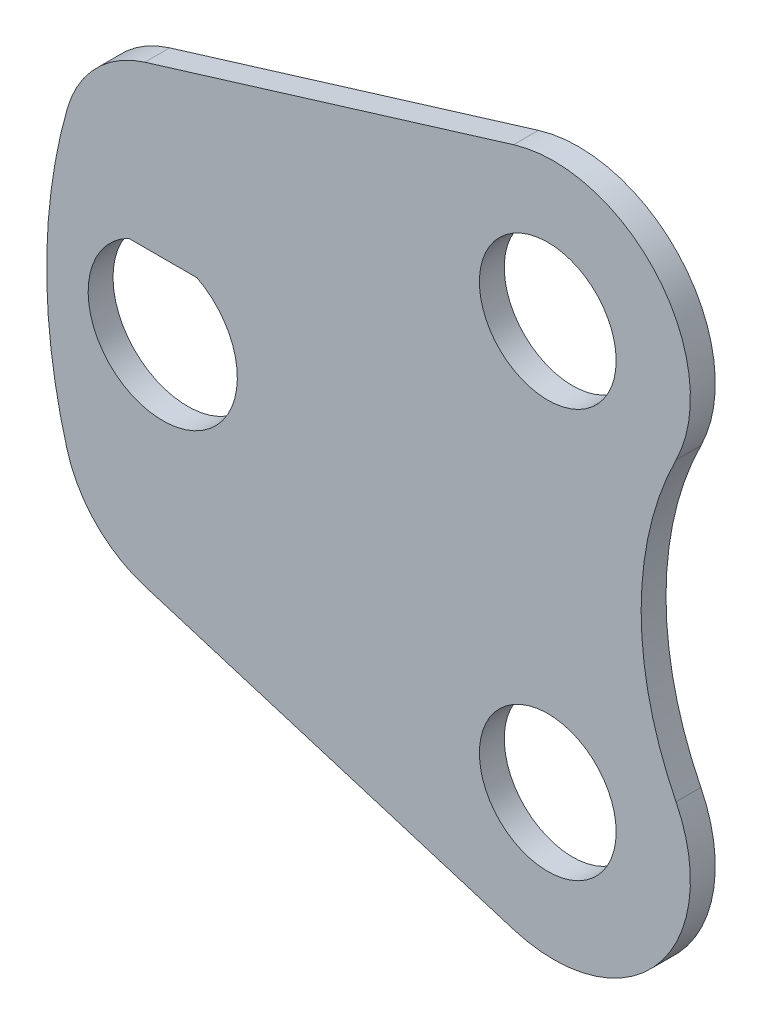
from build123d import *

# Parameters (mm, degrees)
BOSS_EXTRUDE1_DEPTH   = 1.5
IZIM1_R               = 4.125
KES_EKSTR_ZYON1_DEPTH = 5


with BuildPart() as part:
    # Sketch1 → Boss-Extrude1 (new body)
    with BuildSketch(Plane.XY):
        with BuildLine():
            Line((-4.586520611, 20.5), (-26.831876879, 13.6870336))
            ThreePointArc((-26.831876879, 13.6870336), (-29.786221501, 11.888574472), (-31.518862928, 8.895154845))
            ThreePointArc((-31.518862928, 8.895154845), (-32.75, 0), (-31.518862928, -8.895154845))
            ThreePointArc((-31.518862928, -8.895154845), (-29.786221501, -11.888574472), (-26.831876879, -13.6870336))
            Line((-26.831876879, -13.6870336), (-4.586520611, -20.5))
            ThreePointArc((-4.586520611, -20.5), (4.125457599, -17.942905427), (5.211648434, -8.928611974))
            ThreePointArc((5.211648434, -8.928611974), (3.108013658, 0), (5.211648434, 8.928611974))
            ThreePointArc((5.211648434, 8.928611974), (4.125457599, 17.942905427), (-4.586520611, 20.5))
        make_face()
        with BuildLine():
            Line((-23.688447187, 4), (-27.811552813, 4))
            ThreePointArc((-27.811552813, 4), (-25.75, -4.5), (-23.688447187, 4))
        make_face(mode=Mode.SUBTRACT)
    extrude(amount=BOSS_EXTRUDE1_DEPTH)

    # Çizim1 → Kes-Ekstrüzyon1 (cut, symmetric)
    with BuildSketch(Plane(origin=(0, 0, 0), x_dir=(-1, 0, 0), z_dir=(0, 0, -1))):
        with Locations(Location((2.524172848, -12.31, 0), (0, 0, 180))):
            Circle(IZIM1_R)
        with Locations(Location((2.524172848, 12.31, 0), (0, 0, 180))):
            Circle(IZIM1_R)
    extrude(amount=KES_EKSTR_ZYON1_DEPTH, both=True, mode=Mode.SUBTRACT)


solid = part.part
